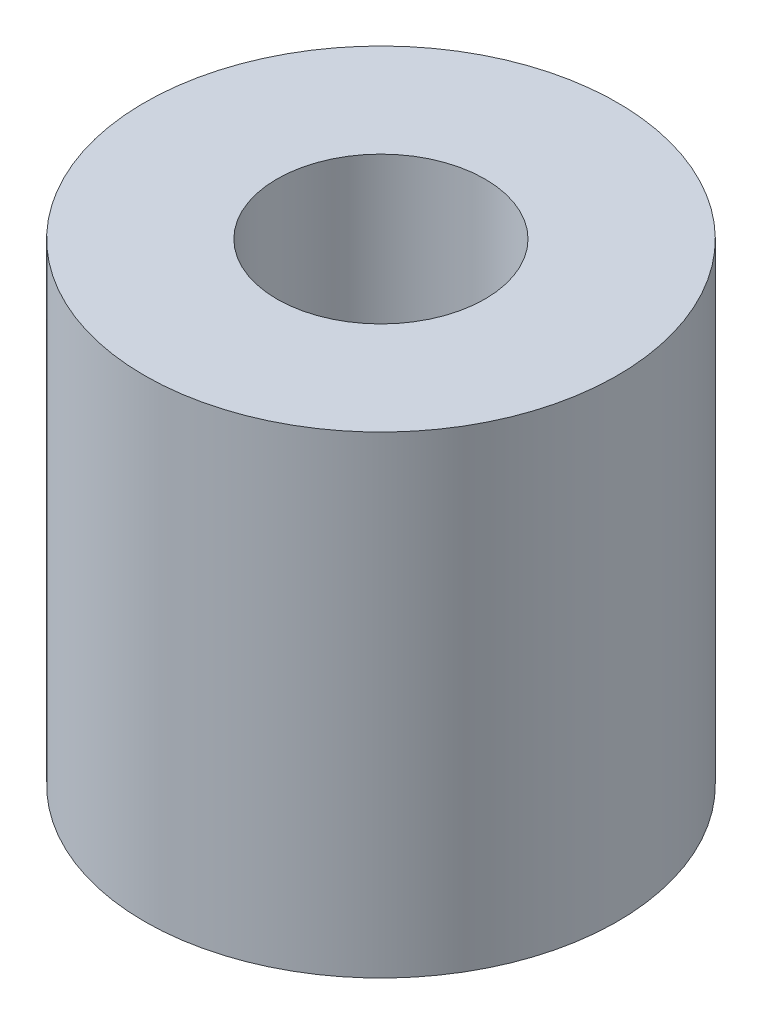
from build123d import *

# Parameters (mm, degrees)
SKETCH1_R           = 2.5
SKETCH1_R_2         = 1.1
BOSS_EXTRUDE1_DEPTH = 5


with BuildPart() as part:
    # Sketch1 → Boss-Extrude1 (new body)
    with BuildSketch(Plane(origin=(0, 0, 0), x_dir=(1, 0, 0), z_dir=(0, 1, 0))):
        with Locations(Location((0, 0, 0), (0, 0, 270))):
            Circle(SKETCH1_R)
        with Locations(Location((0, 0, 0), (0, 0, 270))):
            Circle(SKETCH1_R_2, mode=Mode.SUBTRACT)
    extrude(amount=BOSS_EXTRUDE1_DEPTH)


solid = part.part
